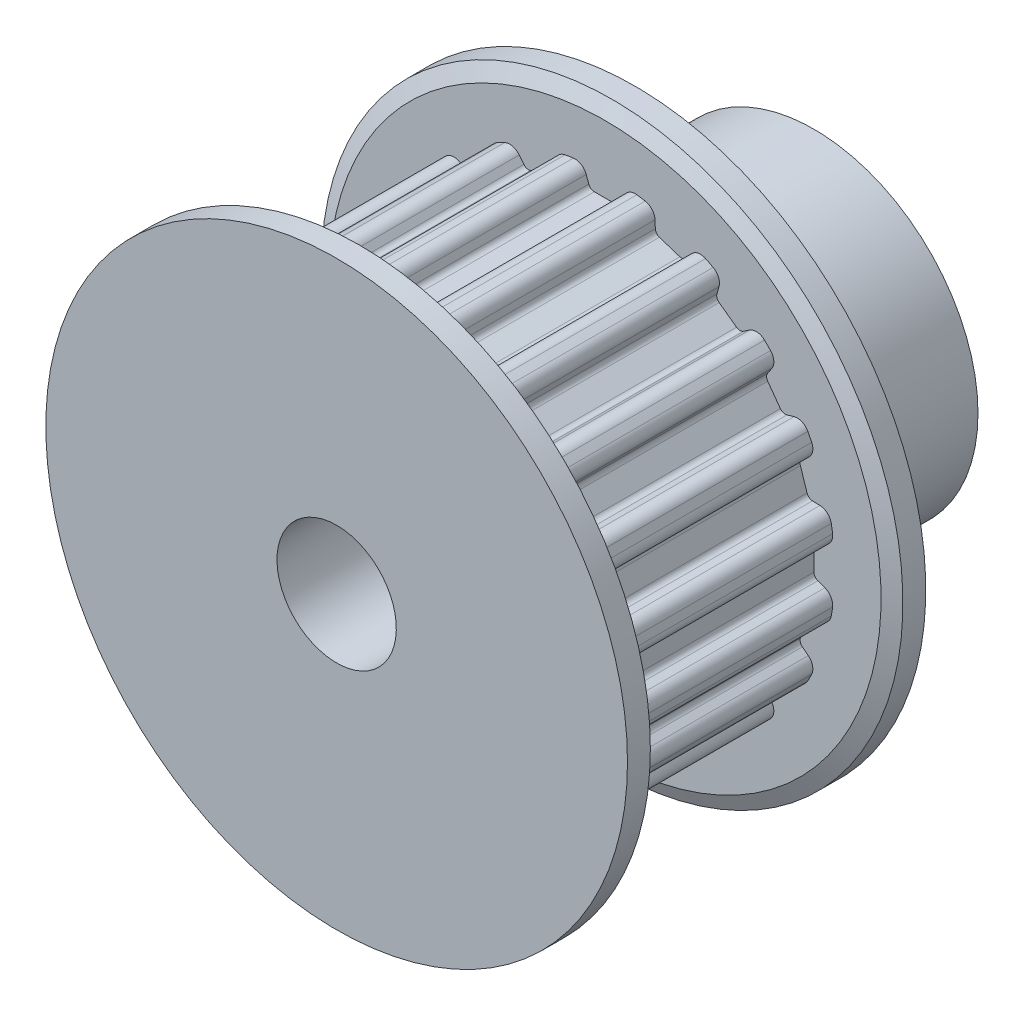
from build123d import *

# Parameters (mm, degrees)
SKETCH5_W           = 10
SKETCH5_H           = 7.7
SKETCH16_W          = 6
SKETCH16_H          = 5.5
SKETCH17_W          = 16
SKETCH17_H          = 2
CUT_TOOTH_REACH     = 21.354
PATTERN_TOOTH_COUNT = 20


with BuildPart() as part:
    # Sketch5 → body (revolve)
    with BuildSketch(Plane(origin=(0, 0, 0), x_dir=(0, 0, -1), z_dir=(1, 0, 0))):
        with Locations((5, 3.85)):
            Rectangle(SKETCH5_W, SKETCH5_H)
    revolve(axis=Axis((0, 0, 0), (0, 0, -1)))

    # Sketch16 → body-hub (revolve)
    with BuildSketch(Plane(origin=(0, 0, 0), x_dir=(0, 0, -1), z_dir=(1, 0, 0))):
        with Locations((13, 2.75)):
            Rectangle(SKETCH16_W, SKETCH16_H)
    revolve(axis=Axis((0, 0, -16), (0, 0, 1)))

    # Sketch17 → body-bore (revolve, cut)
    with BuildSketch(Plane(origin=(0, 0, 0), x_dir=(0, 0, -1), z_dir=(1, 0, 0))):
        with Locations((8, 1)):
            Rectangle(SKETCH17_W, SKETCH17_H)
    revolve(axis=Axis((0, 0, -16), (0, 0, 1)), mode=Mode.SUBTRACT)

    # Sketch23 → cut-tooth (cut, up to next)
    with BuildSketch(Plane.XY, mode=Mode.PRIVATE) as cut_tooth_sk1:
        with BuildLine():
            Line((0.547897017, 7.131595971), (0.633465137, 7.366692451))
            ThreePointArc((0.633465137, 7.366692451), (0.803169961, 7.572656933), (1.064648607, 7.626042443))
            Line((1.064648607, 7.626042443), (1.064648607, 8.252084886))
            Line((1.064648607, 8.252084886), (-1.064648607, 8.252084886))
            Line((-1.064648607, 8.252084886), (-1.064648607, 7.626042443))
            ThreePointArc((-1.064648607, 7.626042443), (-0.803169961, 7.572656933), (-0.633465137, 7.366692451))
            Line((-0.633465137, 7.366692451), (-0.547897017, 7.131595971))
            ThreePointArc((-0.547897017, 7.131595971), (-0.47467378, 7.036169591), (-0.359958492, 7))
            Line((-0.359958492, 7), (0.359958492, 7))
            ThreePointArc((0.359958492, 7), (0.47467378, 7.036169591), (0.547897017, 7.131595971))
        make_face()
    cut_tooth_tool1 = extrude(cut_tooth_sk1.sketch, amount=-CUT_TOOTH_REACH, mode=Mode.PRIVATE) & part.part
    cut_tooth = cut_tooth_tool1.solids().sort_by_distance((0, 7.717665, 0))[0]
    add(cut_tooth, mode=Mode.SUBTRACT)

    # pattern-tooth: cut-tooth ×20 about axis
    pattern_tooth_axis = Axis((0, 0, -10), (0, 0, 1))
    for i in range(1, PATTERN_TOOTH_COUNT):
        add(cut_tooth.rotate(pattern_tooth_axis, i * 360 / PATTERN_TOOTH_COUNT), mode=Mode.SUBTRACT)

    # Sketch25 → body-flange-front (revolve)
    with BuildSketch(Plane(origin=(0, 0, 0), x_dir=(0, 0, -1), z_dir=(1, 0, 0))):
        Polygon((1, 4.85), (0, 4.85), (0, 8.116666667), (0, 9.75), (1, 9.75), (1, 8.116666667), align=None)
    revolve(axis=Axis((0, 0, 0), (0, 0, -1)))

    # Sketch26 → body-flange-back (revolve)
    with BuildSketch(Plane(origin=(0, 0, 0), x_dir=(0, 0, -1), z_dir=(1, 0, 0))):
        Polygon((9, 4.85), (10, 4.85), (10, 8.116666667), (10, 9.75), (9, 9.75), (9, 8.116666667), align=None)
    revolve(axis=Axis((0, 0, -10), (0, 0, 1)))

    # Sketch28 → body-flange-profile-front (revolve, cut)
    with BuildSketch(Plane(origin=(0, 0, 0), x_dir=(0, 0, -1), z_dir=(1, 0, 0))):
        Polygon((1, 9.75), (1, 9.25), (0.766846171, 9.75), align=None)
    revolve(axis=Axis((0, 0, -10), (0, 0, 1)), mode=Mode.SUBTRACT)

    # Sketch29 → body-flange-profile-back (revolve, cut)
    with BuildSketch(Plane(origin=(0, 0, 0), x_dir=(0, 0, -1), z_dir=(1, 0, 0))):
        Polygon((9, 9.75), (9, 9.25), (9.233153829, 9.75), align=None)
    revolve(axis=Axis((0, 0, -10), (0, 0, 1)), mode=Mode.SUBTRACT)


solid = part.part
